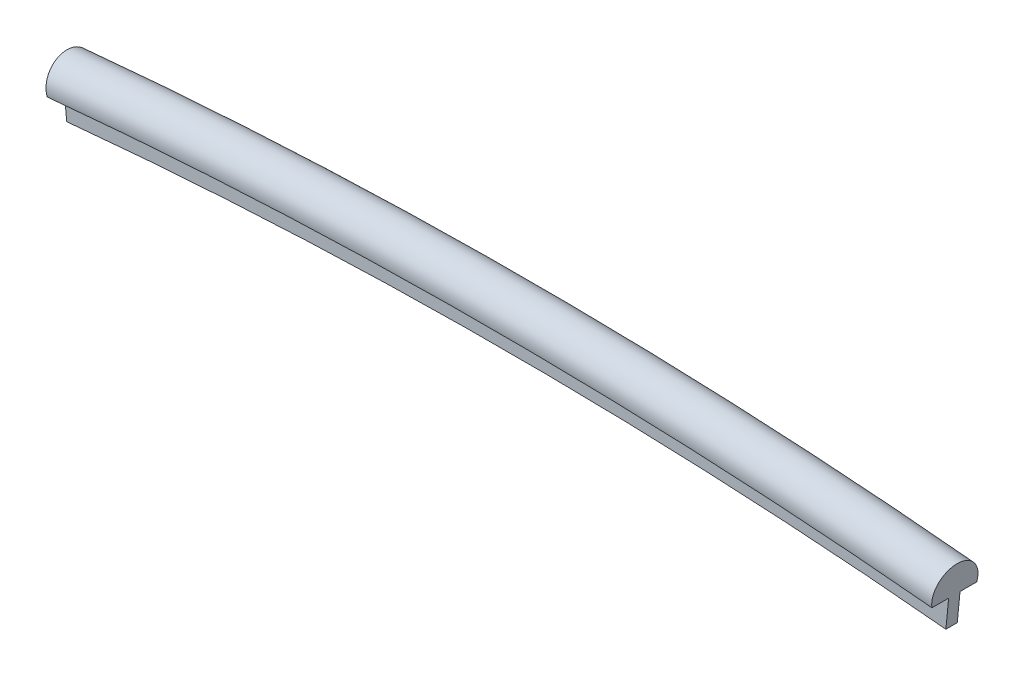
from build123d import *

# Parameters (mm, degrees)
REVOLVE1_ANGLE           = 5.539625632
REVOLVE1_OTHER_WAY_ANGLE = 5.539625632


with BuildPart() as part:
    # Sketch2 → Revolve1 (revolve)
    with BuildSketch(Plane(origin=(0, 0, 0), x_dir=(0, 0, -1), z_dir=(1, 0, 0))):
        with BuildLine():
            Line((0, 239.8), (0.3, 239.8))
            Line((0.3, 239.8), (0.3, 241.3))
            Line((0.3, 241.3), (1.18, 241.3))
            ThreePointArc((1.18, 241.3), (0, 242.800182019), (-1.18, 241.3))
            Line((-1.18, 241.3), (-0.3, 241.3))
            Line((-0.3, 241.3), (-0.3, 239.8))
            Line((-0.3, 239.8), (0, 239.8))
        make_face()
    revolve(axis=Axis((0, 0, 70.597641597), (0, 0, -1)), revolution_arc=REVOLVE1_ANGLE)

    # Sketch2 → Revolve1 other way (revolve)
    with BuildSketch(Plane(origin=(0, 0, 0), x_dir=(0, 0, -1), z_dir=(1, 0, 0))):
        with BuildLine():
            Line((0, 239.8), (0.3, 239.8))
            Line((0.3, 239.8), (0.3, 241.3))
            Line((0.3, 241.3), (1.18, 241.3))
            ThreePointArc((1.18, 241.3), (0, 242.800182019), (-1.18, 241.3))
            Line((-1.18, 241.3), (-0.3, 241.3))
            Line((-0.3, 241.3), (-0.3, 239.8))
            Line((-0.3, 239.8), (0, 239.8))
        make_face()
    revolve(axis=Axis((0, 0, 70.597641597), (0, 0, 1)), revolution_arc=REVOLVE1_OTHER_WAY_ANGLE)


solid = part.part
